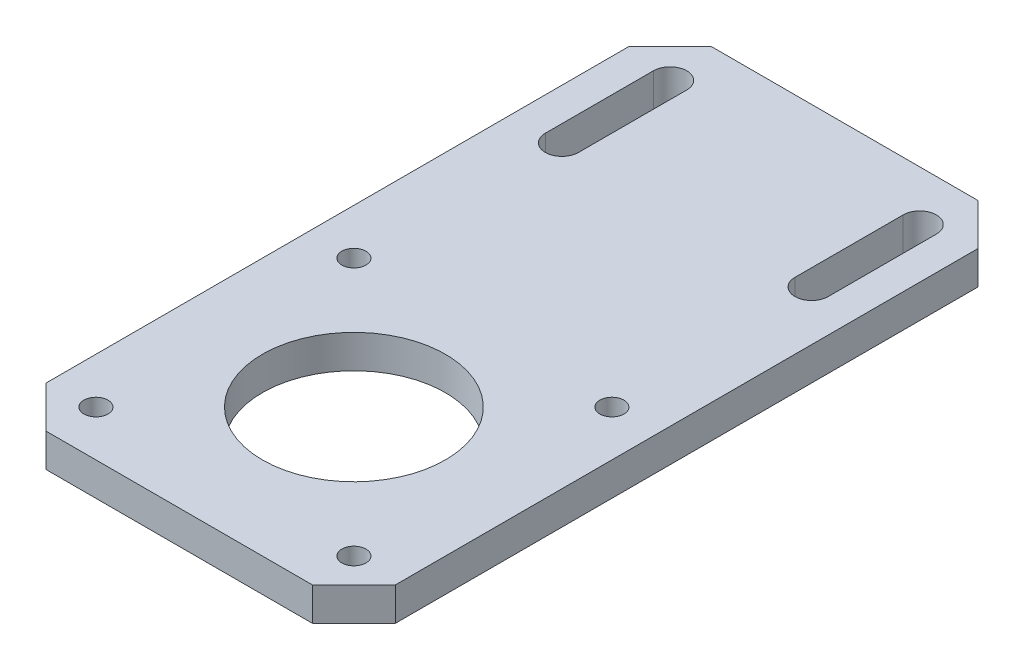
from build123d import *

# Parameters (mm, degrees)
SKETCH_1_W      = 42
SKETCH_1_H      = 80
SKETCH_1_R      = 11
SKETCH_1_R_2    = 1.45
EXTRUDE_1_DEPTH = 4
CHAMFER_1_SIZE  = 5


with BuildPart() as part:
    # 草图1 → 凸台-拉伸1 (new body)
    with BuildSketch(Plane(origin=(0, 0, 0), x_dir=(1, 0, 0), z_dir=(0, 1, 0))):
        with Locations((21, 40)):
            Rectangle(SKETCH_1_W, SKETCH_1_H)
        with Locations(Location((21, 21, 0), (0, 0, 270))):
            Circle(SKETCH_1_R, mode=Mode.SUBTRACT)
        with Locations(Location((5.5, 36.5, 0), (0, 0, 270))):
            Circle(SKETCH_1_R_2, mode=Mode.SUBTRACT)
        with Locations(Location((5.5, 5.5, 0), (0, 0, 270))):
            Circle(SKETCH_1_R_2, mode=Mode.SUBTRACT)
        with Locations(Location((36.5, 36.5, 0), (0, 0, 270))):
            Circle(SKETCH_1_R_2, mode=Mode.SUBTRACT)
        with Locations(Location((36.5, 5.5, 0), (0, 0, 270))):
            Circle(SKETCH_1_R_2, mode=Mode.SUBTRACT)
        with BuildLine():
            Line((8, 74), (8, 61))
            ThreePointArc((8, 61), (6, 59), (4, 61))
            Line((4, 61), (4, 74))
            ThreePointArc((4, 74), (6, 76), (8, 74))
        make_face(mode=Mode.SUBTRACT)
        with BuildLine():
            Line((38, 74), (38, 61))
            ThreePointArc((38, 61), (36, 59), (34, 61))
            Line((34, 61), (34, 74))
            ThreePointArc((34, 74), (36, 76), (38, 74))
        make_face(mode=Mode.SUBTRACT)
    extrude(amount=EXTRUDE_1_DEPTH)

    # 倒角1
    chamfer_1_edges = [part.edges().sort_by_distance(p)[0] for p in [
        (0, 2, -80),
        (42, 2, -80),
        (42, 2, 0),
        (0, 2, 0),
    ]]
    chamfer(chamfer_1_edges, length=CHAMFER_1_SIZE)


solid = part.part
